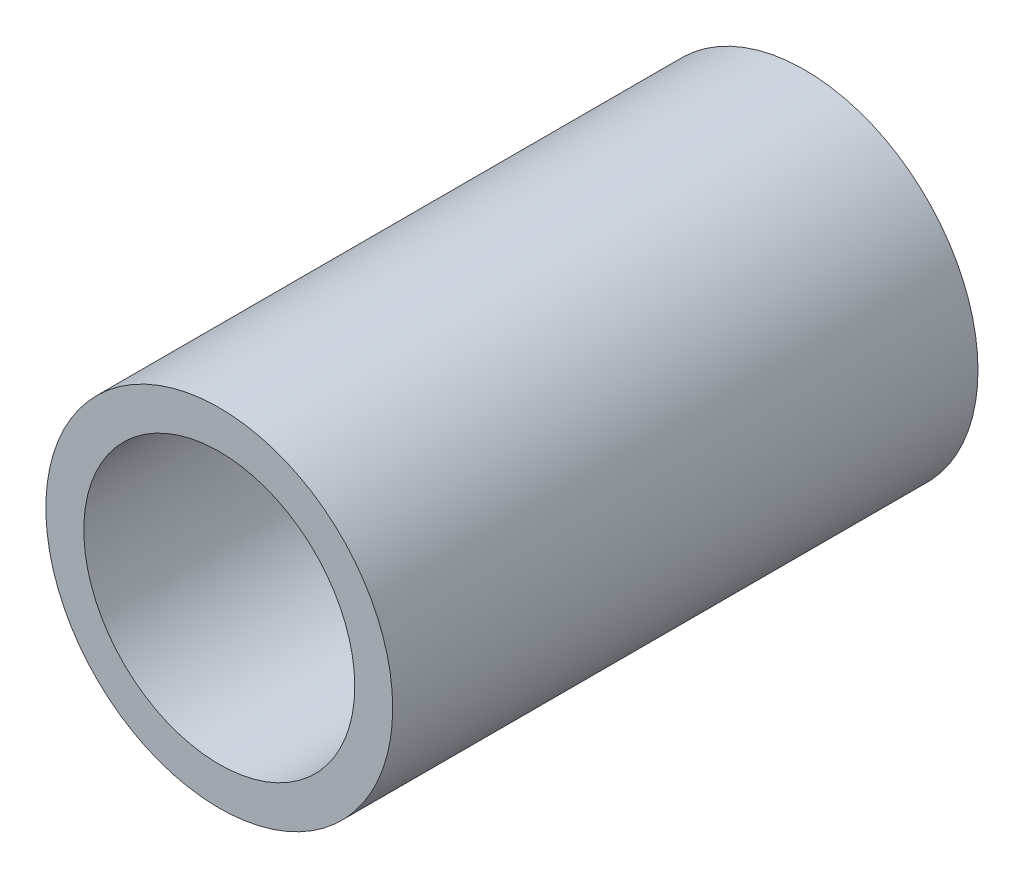
from build123d import *

# Parameters (mm, degrees)
SKETCH1_R           = 16
BOSS_EXTRUDE3_DEPTH = 54
SKETCH2_R           = 12.5
CUT_EXTRUDE2_DEPTH  = 54


with BuildPart() as part:
    # Sketch1 → Boss-Extrude3 (new body)
    with BuildSketch(Plane.XY):
        Circle(SKETCH1_R)
    extrude(amount=BOSS_EXTRUDE3_DEPTH)

    # Sketch2 → Cut-Extrude2 (cut)
    with BuildSketch(Plane.XY.offset(54)):
        Circle(SKETCH2_R)
    extrude(amount=-CUT_EXTRUDE2_DEPTH, mode=Mode.SUBTRACT)


solid = part.part
